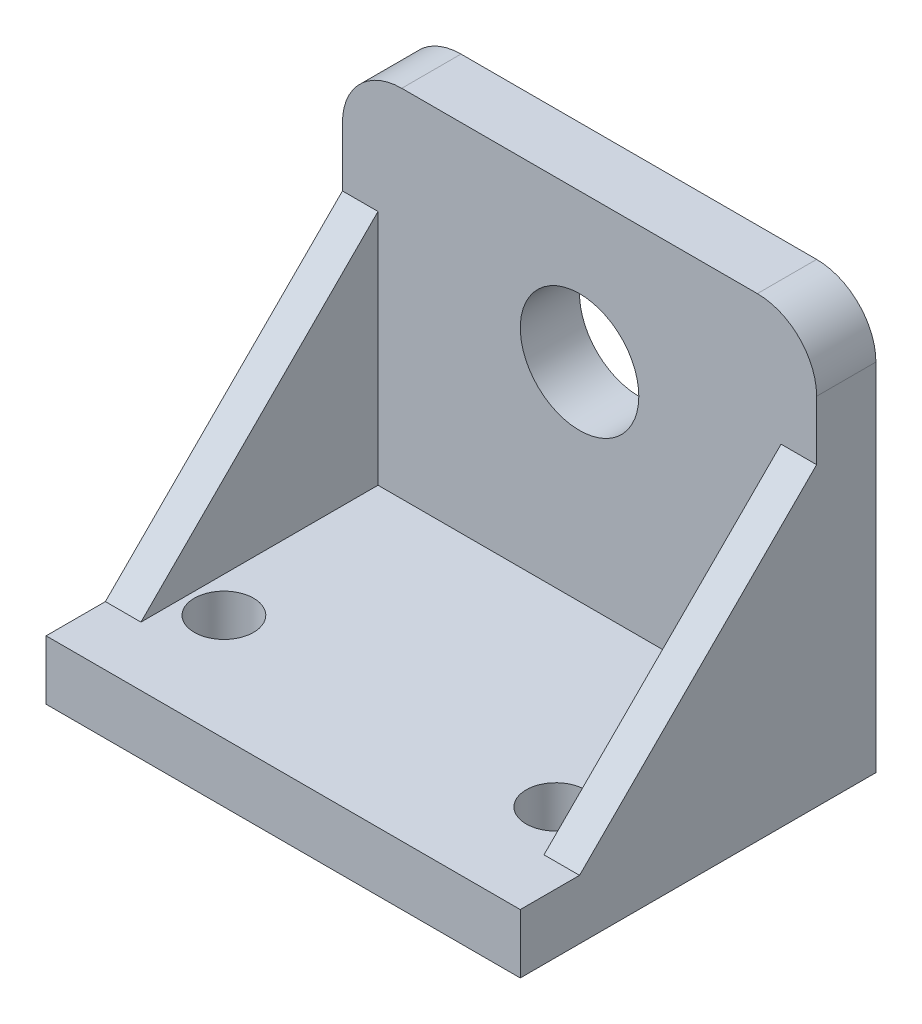
from build123d import *

# Parameters (mm, degrees)
SKETCH_5_W          = 80
SKETCH_5_H          = 60
EXTRUDE_5_DEPTH     = 10
EXTRUDE_6_DEPTH     = 10
EXTRUDE_9_DEPTH     = 6
EXTRUDE_10_DEPTH    = 6
SKETCH_11_R         = 10
CUT_EXTRUDE_1_DEPTH = 101.498756211
SKETCH_13_R         = 5
CUT_EXTRUDE_3_DEPTH = 101.498756211


with BuildPart() as part:
    # 草图5 → 凸台-拉伸5 (new body)
    with BuildSketch(Plane(origin=(0, 0, 0), x_dir=(1, 0, 0), z_dir=(0, 1, 0))):
        with Locations((0, -30)):
            Rectangle(SKETCH_5_W, SKETCH_5_H)
    extrude(amount=EXTRUDE_5_DEPTH)

    # 草图6 → 凸台-拉伸6 (add)
    with BuildSketch(Plane.XY):
        with BuildLine():
            Line((-40, 0), (40, 0))
            Line((40, 0), (40, 60))
            ThreePointArc((40, 60), (37.071067812, 67.071067812), (30, 70))
            Line((30, 70), (-30, 70))
            ThreePointArc((-30, 70), (-37.071067812, 67.071067812), (-40, 60))
            Line((-40, 60), (-40, 0))
        make_face()
    extrude(amount=EXTRUDE_6_DEPTH)

    # 草图9 → 凸台-拉伸9 (add)
    with BuildSketch(Plane(origin=(-40, 0, 0), x_dir=(0, 0, -1), z_dir=(1, 0, 0))):
        Polygon((-10, 10), (-50, 10), (-10, 50), align=None)
    extrude(amount=EXTRUDE_9_DEPTH)

    # 草图10 → 凸台-拉伸10 (add)
    with BuildSketch(Plane(origin=(34, 0, 0), x_dir=(0, 0, -1), z_dir=(1, 0, 0))):
        Polygon((-10, 10), (-50, 10), (-10, 50), align=None)
    extrude(amount=EXTRUDE_10_DEPTH)

    # 草图11 → 切除-拉伸1 (cut, through all)
    with BuildSketch(Plane.XY):
        with Locations((0, 45)):
            Circle(SKETCH_11_R)
    extrude(amount=CUT_EXTRUDE_1_DEPTH, mode=Mode.SUBTRACT)

    # 草图13 → 切除-拉伸3 (cut, through all)
    with BuildSketch(Plane(origin=(0, 0, 0), x_dir=(1, 0, 0), z_dir=(0, 1, 0))):
        with Locations(Location((-28, -42, 0), (0, 0, 90))):
            Circle(SKETCH_13_R)
        with Locations(Location((28, -42, 0), (0, 0, 90))):
            Circle(SKETCH_13_R)
    extrude(amount=CUT_EXTRUDE_3_DEPTH, mode=Mode.SUBTRACT)


solid = part.part
